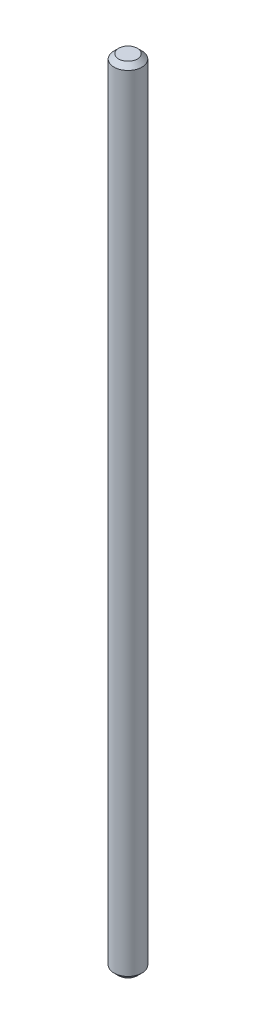
from build123d import *

# Parameters (mm, degrees)
SKETCH2_R           = 1.5
BOSS_EXTRUDE1_DEPTH = 85
CHAMFER1_SIZE       = 0.5


with BuildPart() as part:
    # Sketch2 → Boss-Extrude1 (new body)
    with BuildSketch(Plane(origin=(0, 0, 0), x_dir=(1, 0, 0), z_dir=(0, 1, 0))):
        with Locations(Location((0, 0, 0), (0, 0, 270))):
            Circle(SKETCH2_R)
    extrude(amount=BOSS_EXTRUDE1_DEPTH)

    # Chamfer1
    chamfer1_edges = [part.edges().sort_by_distance(p)[0] for p in [
        (0, 0, -1.5),
        (0, 85, -1.5),
    ]]
    chamfer(chamfer1_edges, length=CHAMFER1_SIZE)


solid = part.part
